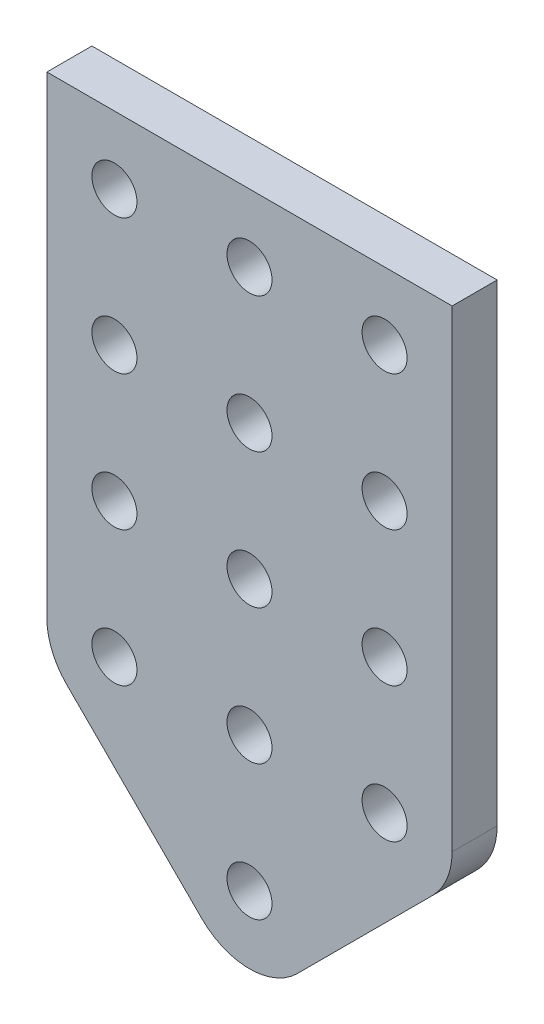
from build123d import *

# Parameters (mm, degrees)
MODEL_R                 = 1.5
SALIENTE_EXTRUIR1_DEPTH = 3


with BuildPart() as part:
    # Model → Saliente-Extruir1 (new body)
    with BuildSketch(Plane.XY):
        with BuildLine():
            Line((174.227054575, 213.178720063), (174.227054575, 204.178720063))
            ThreePointArc((174.227054575, 204.178720063), (174.569596678, 202.456644617), (175.545074059, 200.996739548))
            Line((175.545074059, 200.996739548), (184.545074059, 191.996739548))
            ThreePointArc((184.545074059, 191.996739548), (187.727054575, 190.678720063), (190.90903509, 191.996739548))
            Line((190.90903509, 191.996739548), (199.90903509, 200.996739548))
            ThreePointArc((199.90903509, 200.996739548), (200.884512471, 202.456644617), (201.227054575, 204.178720063))
            Line((201.227054575, 204.178720063), (201.227054575, 235.678720063))
            Line((201.227054575, 235.678720063), (174.227054575, 235.678720063))
            Line((174.227054575, 235.678720063), (174.227054575, 213.178720063))
        make_face()
        with Locations((187.727054575, 204.178720063)):
            Circle(MODEL_R, mode=Mode.SUBTRACT)
        with Locations((178.727054575, 204.178720063)):
            Circle(MODEL_R, mode=Mode.SUBTRACT)
        with Locations((187.727054575, 213.178720063)):
            Circle(MODEL_R, mode=Mode.SUBTRACT)
        with Locations((178.727054575, 213.178720063)):
            Circle(MODEL_R, mode=Mode.SUBTRACT)
        with Locations((196.727054575, 213.178720063)):
            Circle(MODEL_R, mode=Mode.SUBTRACT)
        with Locations((187.727054575, 195.178720063)):
            Circle(MODEL_R, mode=Mode.SUBTRACT)
        with Locations((196.727054575, 204.178720063)):
            Circle(MODEL_R, mode=Mode.SUBTRACT)
        with Locations((187.727054575, 222.178720063)):
            Circle(MODEL_R, mode=Mode.SUBTRACT)
        with Locations((178.727054575, 222.178720063)):
            Circle(MODEL_R, mode=Mode.SUBTRACT)
        with Locations((196.727054575, 222.178720063)):
            Circle(MODEL_R, mode=Mode.SUBTRACT)
        with Locations((187.727054575, 231.178720063)):
            Circle(MODEL_R, mode=Mode.SUBTRACT)
        with Locations((178.727054575, 231.178720063)):
            Circle(MODEL_R, mode=Mode.SUBTRACT)
        with Locations((196.727054575, 231.178720063)):
            Circle(MODEL_R, mode=Mode.SUBTRACT)
    extrude(amount=SALIENTE_EXTRUIR1_DEPTH)


solid = part.part
